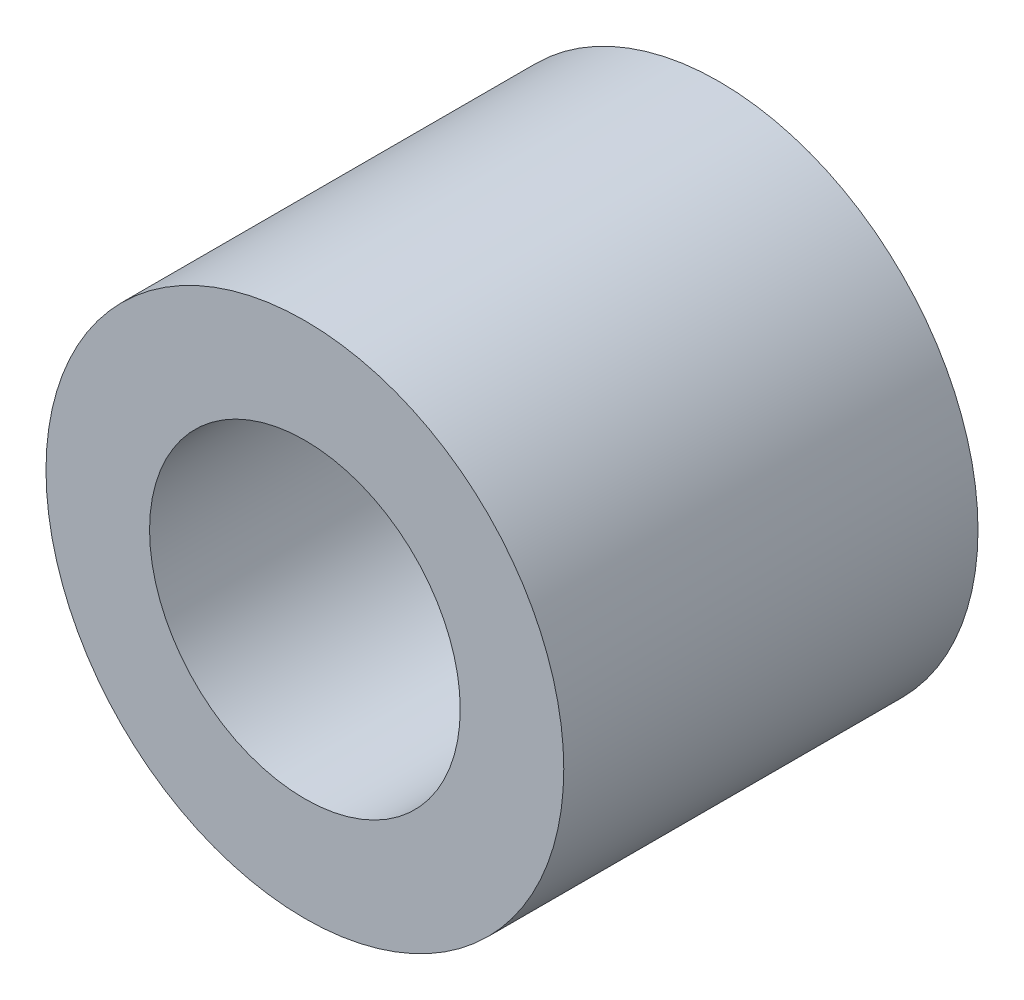
from build123d import *

# Parameters (mm, degrees)
SKETCH_1_R      = 5
SKETCH_1_R_2    = 3
EXTRUDE_1_DEPTH = 8


with BuildPart() as part:
    # 草图1 → 凸台-拉伸1 (new body)
    with BuildSketch(Plane.XY):
        Circle(SKETCH_1_R)
        Circle(SKETCH_1_R_2, mode=Mode.SUBTRACT)
    extrude(amount=-EXTRUDE_1_DEPTH)


solid = part.part
